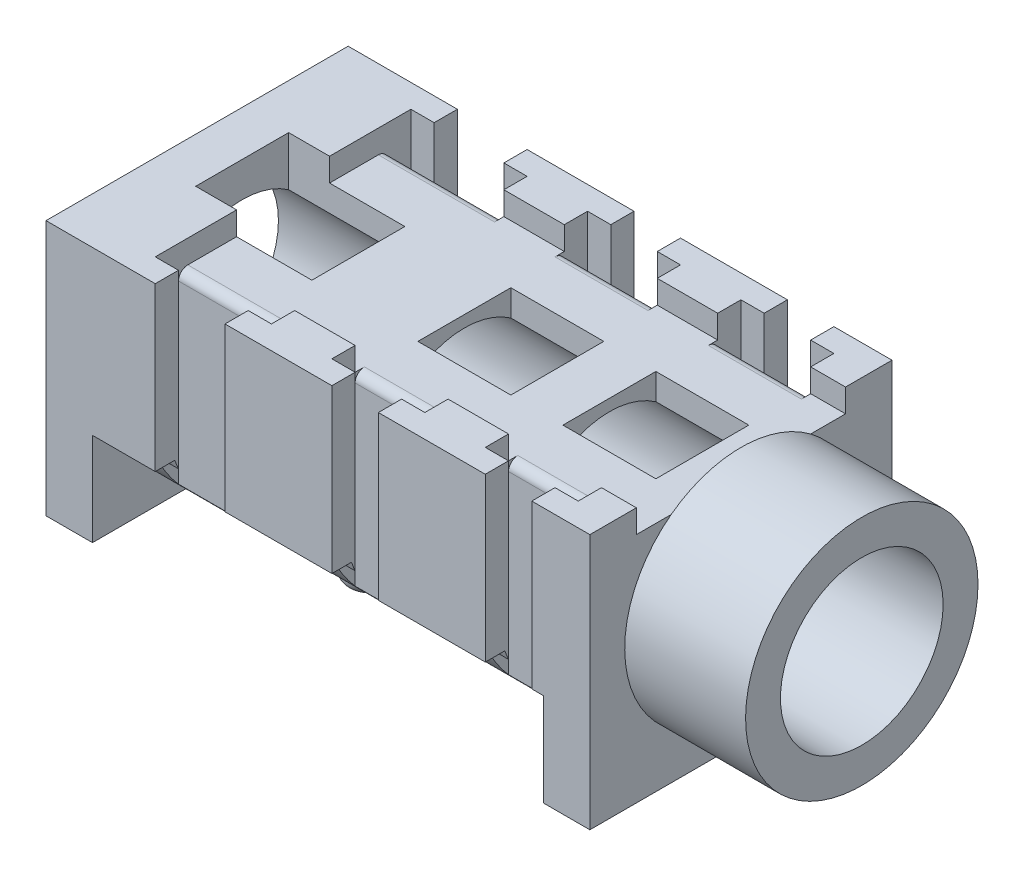
from build123d import *
from build123d.topology import SkipClean

# Parameters (mm, degrees)
SKETCH1_W                            = 11.7
SKETCH1_H                            = 6.5
BOSS_EXTRUDE1_DEPTH                  = 5.5
SKETCH2_R                            = 1.75
CUT_EXTRUDE1_DEPTH                   = 15.5
BOSS_EXTRUDE2_START                  = 2.6
SKETCH3_R                            = 2.5
SKETCH3_R_2                          = 1.75
BOSS_EXTRUDE2_DEPTH                  = 2.6
CUT_EXTRUDE2_START                   = -1
CUT_EXTRUDE2_DEPTH                   = 9.7
CUT_EXTRUDE3_DEPTH                   = 10
SKETCH6_W                            = 2.5
SKETCH6_H                            = 2
SKETCH6_W_2                          = 2
CUT_EXTRUDE4_DEPTH                   = 2
SKETCH7_W                            = 9.85
SKETCH7_H                            = 4.5
CUT_EXTRUDE5_DEPTH                   = 0.5
FILLET1_R                            = 0.2
SKETCH8_R                            = 0.5
BOSS_EXTRUDE3_DEPTH                  = 1
BOSS_EXTRUDE3_DIRECTION_2_REACH      = 12.593
BOSS_EXTRUDE3_DIRECTION_2_END_RADIUS = 3
FILLET2_R                            = 0.3


with BuildPart() as part:
    # Sketch1 → Boss-Extrude1 (new body)
    with BuildSketch(Plane(origin=(0, 0, 0), x_dir=(1, 0, 0), z_dir=(0, 1, 0))):
        Rectangle(SKETCH1_W, SKETCH1_H)
    extrude(amount=BOSS_EXTRUDE1_DEPTH)

    # Sketch2 → Cut-Extrude1 (cut)
    with BuildSketch(Plane(origin=(5.85, 0, 0), x_dir=(0, 0, -1), z_dir=(1, 0, 0))):
        with Locations((0, 3)):
            Circle(SKETCH2_R)
    extrude(amount=-CUT_EXTRUDE1_DEPTH, mode=Mode.SUBTRACT)

    # Sketch3 → Boss-Extrude2 (add)
    with BuildSketch(Plane(origin=(5.85, 0, 0), x_dir=(0, 0, -1), z_dir=(1, 0, 0)).offset(BOSS_EXTRUDE2_START)):
        with Locations(Location((0, 3, 0), (0, 0, 90))):
            Circle(SKETCH3_R)
        with Locations((0, 3)):
            Circle(SKETCH3_R_2, mode=Mode.SUBTRACT)
    extrude(amount=-BOSS_EXTRUDE2_DEPTH)

    # Sketch4 → Cut-Extrude2 (cut)
    with BuildSketch(Plane(origin=(5.85, 0, 0), x_dir=(0, 0, -1), z_dir=(1, 0, 0)).offset(CUT_EXTRUDE2_START)):
        with BuildLine():
            Line((-4.687033743, 2), (-2.828427125, 2))
            ThreePointArc((-2.828427125, 2), (0, 0), (2.828427125, 2))
            Line((2.828427125, 2), (5.329187563, 2))
            Line((5.329187563, 2), (5.329187563, -1.490759496))
            Line((5.329187563, -1.490759496), (-4.687033743, -1.490759496))
            Line((-4.687033743, -1.490759496), (-4.687033743, 2))
        make_face()
    extrude(amount=-CUT_EXTRUDE2_DEPTH, mode=Mode.SUBTRACT)

    # Sketch5 → Cut-Extrude3 (cut)
    with BuildSketch(Plane(origin=(0, 5.5, 0), x_dir=(1, 0, 0), z_dir=(0, 1, 0))):
        Polygon((-3.5, 4.45), (-2, 4.45), (-2, 2.75), (-1.5, 2.75), (-1.5, 2.25), (-4, 2.25), (-4, 2.75), (-3.5, 2.75), align=None)
        Polygon((0.3, 4.45), (1.3, 4.45), (1.3, 2.75), (1.8, 2.75), (1.8, 2.25), (-0.2, 2.25), (-0.2, 2.75), (0.3, 2.75), align=None)
        Polygon((3.6, 4.45), (4.6, 4.45), (4.6, 2.75), (5.1, 2.75), (5.1, 2.25), (3.1, 2.25), (3.1, 2.75), (3.6, 2.75), align=None)
        Polygon((1.3, -2.75), (1.8, -2.75), (1.8, -2.25), (-0.2, -2.25), (-0.2, -2.75), (0.3, -2.75), (0.3, -4.45), (1.3, -4.45), align=None)
        Polygon((-2, -2.75), (-1.5, -2.75), (-1.5, -2.25), (-4, -2.25), (-4, -2.75), (-3.5, -2.75), (-3.5, -4.45), (-2, -4.45), align=None)
        Polygon((5.1, -2.25), (5.1, -2.75), (4.6, -2.75), (4.6, -4.45), (3.6, -4.45), (3.6, -2.75), (3.1, -2.75), (3.1, -2.25), align=None)
    extrude(amount=-CUT_EXTRUDE3_DEPTH, mode=Mode.SUBTRACT)

    # Sketch6 → Cut-Extrude4 (cut)
    with BuildSketch(Plane(origin=(0, 5.5, 0), x_dir=(1, 0, 0), z_dir=(0, 1, 0))):
        with Locations((-3.63, 0)):
            Rectangle(SKETCH6_W, SKETCH6_H)
        with Locations((0.9, 0)):
            Rectangle(SKETCH6_W_2, SKETCH6_H)
        with Locations((4.02, 0)):
            Rectangle(SKETCH6_W_2, SKETCH6_H)
    extrude(amount=-CUT_EXTRUDE4_DEPTH, mode=Mode.SUBTRACT)

    # Sketch7 → Cut-Extrude5 (cut)
    with BuildSketch(Plane(origin=(0, 5.5, 0), x_dir=(1, 0, 0), z_dir=(0, 1, 0))):
        with Locations((0.925, 0)):
            Rectangle(SKETCH7_W, SKETCH7_H)
    extrude(amount=-CUT_EXTRUDE5_DEPTH, mode=Mode.SUBTRACT)

    # Fillet1
    fillet1_edges = [part.edges().sort_by_distance(p)[0] for p in [
        (-2.75, 5, -2.25),
        (0.8, 5, -2.25),
        (4.1, 5, 2.25),
        (0.8, 5, 2.25),
        (-2.75, 5, 2.25),
        (4.1, 5, -2.25),
    ]]
    fillet(fillet1_edges, radius=FILLET1_R)

    # Sketch8 → Boss-Extrude3 (add)
    with BuildSketch(Plane.XZ):
        with Locations(Location((4.05, 0, 0), (0, 0, 90))):
            Circle(SKETCH8_R)
        with Locations(Location((-2.15, 0, 0), (0, 0, 90))):
            Circle(SKETCH8_R)
    extrude(amount=BOSS_EXTRUDE3_DEPTH)

    # Boss-Extrude3 direction 2: up to this cylinder (the profile starts outside it)
    with SkipClean():  # the faces are left unmerged after this step: merging them gives an invalid solid
        boss_extrude3_direction_2_end = Plane(origin=(0.95, 3, 0), z_dir=(1, 0, 0)) * Cylinder(BOSS_EXTRUDE3_DIRECTION_2_END_RADIUS, 38.386, mode=Mode.PRIVATE)
        # Sketch8 → Boss-Extrude3 direction 2 (add, up to the surface)
        with BuildSketch(Plane.XZ, mode=Mode.PRIVATE) as boss_extrude3_direction_2_sk1:
            with Locations(Location((4.05, 0, 0), (0, 0, 90))):
                Circle(SKETCH8_R)
        boss_extrude3_direction_2_tool1 = extrude(boss_extrude3_direction_2_sk1.sketch, amount=-BOSS_EXTRUDE3_DIRECTION_2_REACH, mode=Mode.PRIVATE) - boss_extrude3_direction_2_end
        add(boss_extrude3_direction_2_tool1.solids().sort_by_distance((4.05, 0, 0))[0])
        add(boss_extrude3_direction_2_tool1.solids().sort_by_distance((4.05, 0, 0))[1])
        # Sketch8 → Boss-Extrude3 direction 2 (add, up to the surface)
        with BuildSketch(Plane.XZ, mode=Mode.PRIVATE) as boss_extrude3_direction_2_sk2:
            with Locations(Location((-2.15, 0, 0), (0, 0, 90))):
                Circle(SKETCH8_R)
        boss_extrude3_direction_2_tool2 = extrude(boss_extrude3_direction_2_sk2.sketch, amount=-BOSS_EXTRUDE3_DIRECTION_2_REACH, mode=Mode.PRIVATE) - boss_extrude3_direction_2_end
        add(boss_extrude3_direction_2_tool2.solids().sort_by_distance((-2.15, 0, 0))[0])
        add(boss_extrude3_direction_2_tool2.solids().sort_by_distance((-2.15, 0, 0))[1])

    # Fillet2
    fillet2_edges = [part.edges().sort_by_distance(p)[0] for p in [
        (4.05, -1, -0.5),
        (-2.15, -1, -0.5),
    ]]
    fillet(fillet2_edges, radius=FILLET2_R)


solid = part.part
